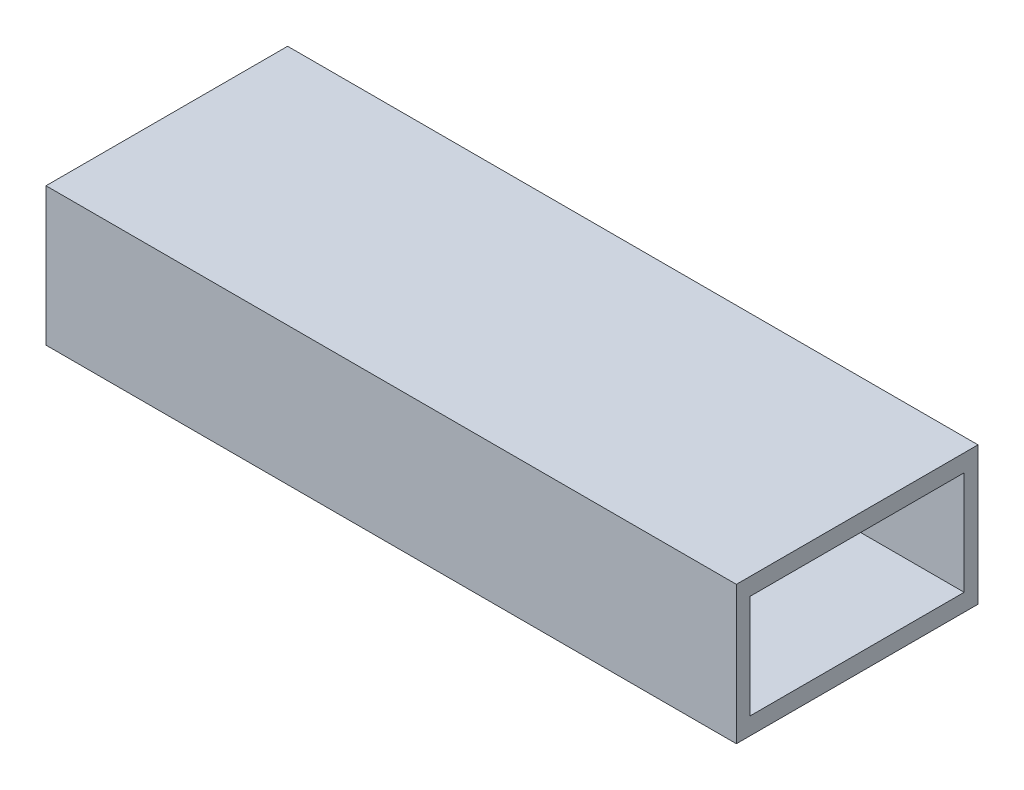
from build123d import *

# Parameters (mm, degrees)
SKETCH_1_W      = 35
SKETCH_1_H      = 20
SKETCH_1_W_2    = 31
SKETCH_1_H_2    = 15
EXTRUDE_1_DEPTH = 100


with BuildPart() as part:
    # 草图1 → 凸台-拉伸1 (new body)
    with BuildSketch(Plane(origin=(0, 0, 0), x_dir=(0, 0, -1), z_dir=(1, 0, 0))):
        Rectangle(SKETCH_1_W, SKETCH_1_H)
        Rectangle(SKETCH_1_W_2, SKETCH_1_H_2, mode=Mode.SUBTRACT)
    extrude(amount=EXTRUDE_1_DEPTH)


solid = part.part
